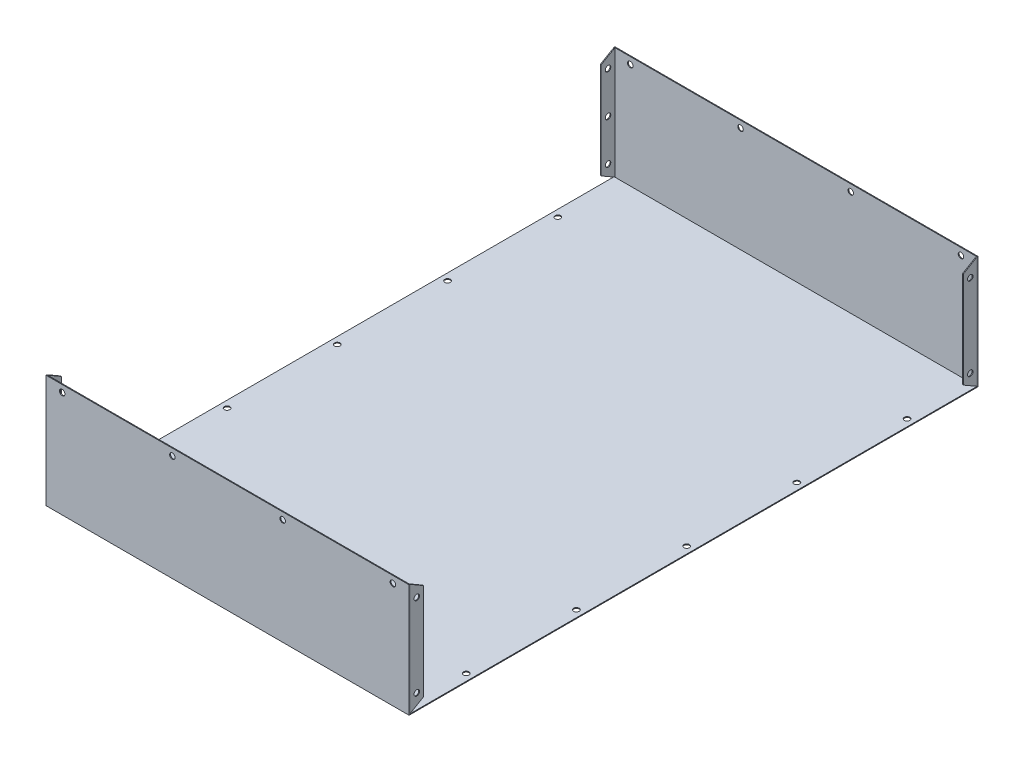
from build123d import *

# Parameters (mm, degrees)
SKETCH_1_W          = 263.5
SKETCH_1_H          = 412.9
EXTRUDE_1_DEPTH     = 0.6
SKETCH_2_W          = 0.6
SKETCH_2_H          = 82
EXTRUDE_2_DEPTH     = 263.5
SKETCH_3_R          = 2
EXTRUDE_3_DEPTH     = 0.6
SKETCH_4_R          = 2
EXTRUDE_4_DEPTH     = 0.6
EXTRUDE_4_2_DEPTH   = 0.6
SKETCH_6_R          = 2
CUT_EXTRUDE_1_DEPTH = 259.080655997
CUT_EXTRUDE_2_REACH = 443.099
SKETCH_7_R          = 2


with BuildPart() as part:
    # Эскиз1 → Бобышка-Вытянуть1 (new body)
    with BuildSketch(Plane(origin=(0, 0, 0), x_dir=(1, 0, 0), z_dir=(0, 1, 0))):
        Rectangle(SKETCH_1_W, SKETCH_1_H)
    extrude(amount=EXTRUDE_1_DEPTH)

    # Эскиз2 → Бобышка-Вытянуть2 (add)
    with BuildSketch(Plane(origin=(131.75, 0, 0), x_dir=(0, 0, -1), z_dir=(1, 0, 0))):
        with Locations((-206.15, 41)):
            Rectangle(SKETCH_2_W, SKETCH_2_H)
        with Locations((206.15, 41)):
            Rectangle(SKETCH_2_W, SKETCH_2_H)
    extrude(amount=-EXTRUDE_2_DEPTH)

    # Эскиз3 → Бобышка-Вытянуть3 (add)
    # profile 1 of 2: a face of its own
    with BuildSketch(Plane.ZY.offset(131.75)):
        Polygon((-205.85, 82), (-195.85, 76.226497308), (-195.85, 6.373502692), (-205.85, 0.6), align=None)
        with Locations((-200.85, 71.3)):
            Circle(SKETCH_3_R, mode=Mode.SUBTRACT)
        with Locations((-200.85, 41.3)):
            Circle(SKETCH_3_R, mode=Mode.SUBTRACT)
        with Locations((-200.85, 11.3)):
            Circle(SKETCH_3_R, mode=Mode.SUBTRACT)
    # profile 2 of 2: a face of its own
    with BuildSketch(Plane.ZY.offset(131.75)):
        Polygon((205.85, 0.6), (195.85, 6.373502692), (195.85, 76.226497308), (205.85, 82), align=None)
        with Locations((200.85, 71.3)):
            Circle(SKETCH_3_R, mode=Mode.SUBTRACT)
        with Locations((200.85, 41.3)):
            Circle(SKETCH_3_R, mode=Mode.SUBTRACT)
        with Locations((200.85, 11.3)):
            Circle(SKETCH_3_R, mode=Mode.SUBTRACT)
    extrude(amount=-EXTRUDE_3_DEPTH)

    # Эскиз6 → Вырез-Вытянуть1 (cut, through all)
    with BuildSketch(Plane(origin=(0, 0.6, 0), x_dir=(1, 0, 0), z_dir=(0, 1, 0))):
        with Locations(Location((-126.75, -160, 0), (0, 0, 270))):
            Circle(SKETCH_6_R)
        with Locations(Location((-126.75, -80, 0), (0, 0, 270))):
            Circle(SKETCH_6_R)
        with Locations(Location((-126.75, 0, 0), (0, 0, 270))):
            Circle(SKETCH_6_R)
        with Locations(Location((-126.75, 80, 0), (0, 0, 270))):
            Circle(SKETCH_6_R)
        with Locations(Location((-126.75, 160, 0), (0, 0, 270))):
            Circle(SKETCH_6_R)
        with Locations(Location((126.75, -160, 0), (0, 0, 270))):
            Circle(SKETCH_6_R)
        with Locations(Location((126.75, -80, 0), (0, 0, 270))):
            Circle(SKETCH_6_R)
        with Locations(Location((126.75, 0, 0), (0, 0, 270))):
            Circle(SKETCH_6_R)
        with Locations(Location((126.75, 80, 0), (0, 0, 270))):
            Circle(SKETCH_6_R)
        with Locations(Location((126.75, 160, 0), (0, 0, 270))):
            Circle(SKETCH_6_R)
    extrude(amount=-CUT_EXTRUDE_1_DEPTH, mode=Mode.SUBTRACT)

    # Вырез-Вытянуть2: up to this face of the body (flat: up to its plane)
    cut_extrude_2_end = Plane(part.part.faces().sort_by_distance((0, 41, 206.45))[0])
    # Эскиз7 → Вырез-Вытянуть2 (cut, up to the picked face)
    with BuildSketch(Plane(origin=(0, 0, -206.45), x_dir=(-1, 0, 0), z_dir=(0, 0, -1)), mode=Mode.PRIVATE) as cut_extrude_2_sk1:
        with Locations((-120, 77)):
            Circle(SKETCH_7_R)
    cut_extrude_2_tool1 = split(extrude(cut_extrude_2_sk1.sketch, amount=-CUT_EXTRUDE_2_REACH, mode=Mode.PRIVATE), bisect_by=cut_extrude_2_end, keep=Keep.BOTH, mode=Mode.PRIVATE)
    # Эскиз7 → Вырез-Вытянуть2 (cut, up to the picked face)
    with BuildSketch(Plane(origin=(0, 0, -206.45), x_dir=(-1, 0, 0), z_dir=(0, 0, -1)), mode=Mode.PRIVATE) as cut_extrude_2_sk2:
        with Locations((-40, 77)):
            Circle(SKETCH_7_R)
    cut_extrude_2_tool2 = split(extrude(cut_extrude_2_sk2.sketch, amount=-CUT_EXTRUDE_2_REACH, mode=Mode.PRIVATE), bisect_by=cut_extrude_2_end, keep=Keep.BOTH, mode=Mode.PRIVATE)
    # Эскиз7 → Вырез-Вытянуть2 (cut, up to the picked face)
    with BuildSketch(Plane(origin=(0, 0, -206.45), x_dir=(-1, 0, 0), z_dir=(0, 0, -1)), mode=Mode.PRIVATE) as cut_extrude_2_sk3:
        with Locations((40, 77)):
            Circle(SKETCH_7_R)
    cut_extrude_2_tool3 = split(extrude(cut_extrude_2_sk3.sketch, amount=-CUT_EXTRUDE_2_REACH, mode=Mode.PRIVATE), bisect_by=cut_extrude_2_end, keep=Keep.BOTH, mode=Mode.PRIVATE)
    # Эскиз7 → Вырез-Вытянуть2 (cut, up to the picked face)
    with BuildSketch(Plane(origin=(0, 0, -206.45), x_dir=(-1, 0, 0), z_dir=(0, 0, -1)), mode=Mode.PRIVATE) as cut_extrude_2_sk4:
        with Locations((120, 77)):
            Circle(SKETCH_7_R)
    cut_extrude_2_tool4 = split(extrude(cut_extrude_2_sk4.sketch, amount=-CUT_EXTRUDE_2_REACH, mode=Mode.PRIVATE), bisect_by=cut_extrude_2_end, keep=Keep.BOTH, mode=Mode.PRIVATE)
    add(cut_extrude_2_tool1.solids().sort_by(Axis((120, 77, -206.45), (0, 0, 1)))[0], mode=Mode.SUBTRACT)
    add(cut_extrude_2_tool2.solids().sort_by(Axis((40, 77, -206.45), (0, 0, 1)))[0], mode=Mode.SUBTRACT)
    add(cut_extrude_2_tool3.solids().sort_by(Axis((-40, 77, -206.45), (0, 0, 1)))[0], mode=Mode.SUBTRACT)
    add(cut_extrude_2_tool4.solids().sort_by(Axis((-120, 77, -206.45), (0, 0, 1)))[0], mode=Mode.SUBTRACT)


with BuildPart() as body_2:
    # Эскиз4 → Бобышка-Вытянуть4 (new body)
    with BuildSketch(Plane(origin=(131.75, 0, 0), x_dir=(0, 0, -1), z_dir=(1, 0, 0))):
        Polygon((205.85, 0.6), (195.85, 6.373502692), (195.85, 76.226497308), (205.85, 82), align=None)
        with Locations((200.85, 11.3)):
            Circle(SKETCH_4_R, mode=Mode.SUBTRACT)
        with Locations((200.85, 71.3)):
            Circle(SKETCH_4_R, mode=Mode.SUBTRACT)
    extrude(amount=-EXTRUDE_4_DEPTH)


with BuildPart() as body_3:
    # Эскиз4 → Extrude 4 2 (new body)
    with BuildSketch(Plane(origin=(131.75, 0, 0), x_dir=(0, 0, -1), z_dir=(1, 0, 0))):
        Polygon((-195.85, 6.373502692), (-205.85, 0.6), (-205.85, 82), (-195.85, 76.226497308), align=None)
        with Locations((-200.85, 11.3)):
            Circle(SKETCH_4_R, mode=Mode.SUBTRACT)
        with Locations((-200.85, 71.3)):
            Circle(SKETCH_4_R, mode=Mode.SUBTRACT)
    extrude(amount=-EXTRUDE_4_2_DEPTH)


solid = Compound([part.part, body_2.part, body_3.part])
